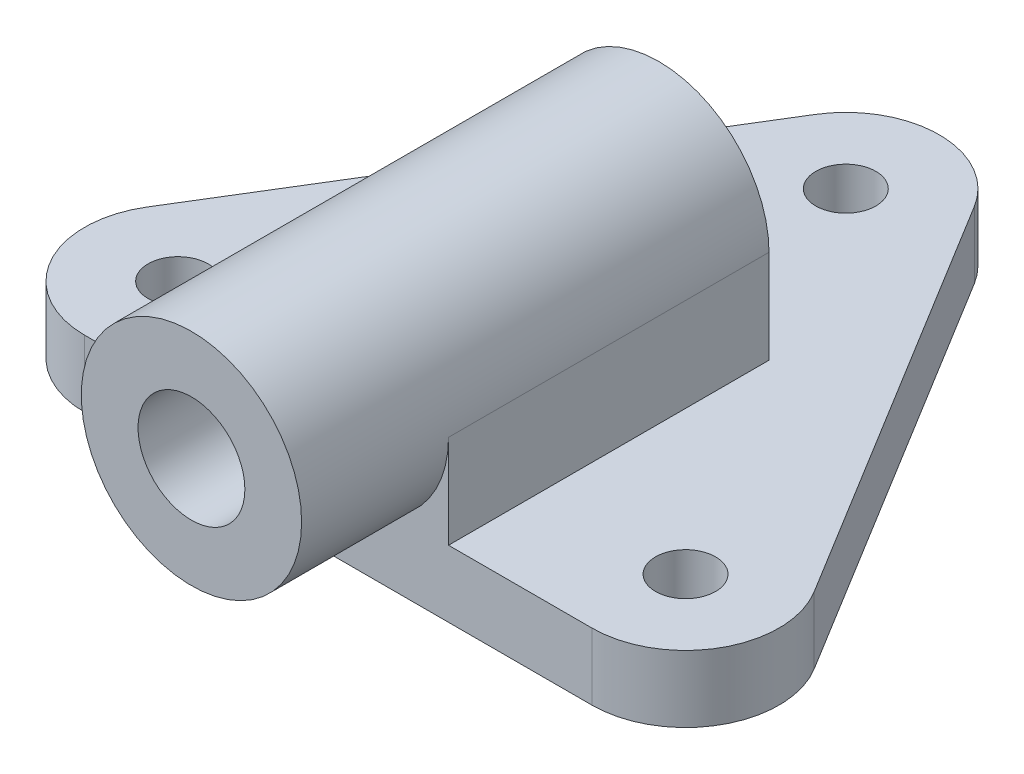
from build123d import *

# Parameters (mm, degrees)
SKETCH2_R                  = 4.5
BOSS_EXTRUDE1_DEPTH        = 10
BOSS_EXTRUDE5_DEPTH        = 22
BOSS_EXTRUDE5_DEPTH_BACK   = 48
SKETCH3_R                  = 16.5
BOSS_EXTRUDE6_DEPTH        = 48
F_16_0MM_DOWEL_HOLE1_D     = 16
F_16_0MM_DOWEL_HOLE1_DEPTH = 54
F_16_0MM_DOWEL_HOLE1_TIP   = 4.806884952


with BuildPart() as part:
    # Sketch2 → Boss-Extrude1 (new body)
    with BuildSketch(Plane(origin=(0, 0, 0), x_dir=(1, 0, 0), z_dir=(0, 1, 0))):
        with BuildLine():
            Line((11.936417534, 69.315868811), (49.936417534, 7.315868811))
            ThreePointArc((49.936417534, 7.315868811), (50.215198798, -6.840242563), (38, -14))
            Line((38, -14), (-38, -14))
            ThreePointArc((-38, -14), (-50.215198798, -6.840242563), (-49.936417534, 7.315868811))
            Line((-49.936417534, 7.315868811), (-11.936417534, 69.315868811))
            ThreePointArc((-11.936417534, 69.315868811), (0, 76), (11.936417534, 69.315868811))
        make_face()
        with Locations((0, 62)):
            Circle(SKETCH2_R, mode=Mode.SUBTRACT)
        with Locations((38, 0)):
            Circle(SKETCH2_R, mode=Mode.SUBTRACT)
        with Locations((-38, 0)):
            Circle(SKETCH2_R, mode=Mode.SUBTRACT)
    extrude(amount=BOSS_EXTRUDE1_DEPTH)

    # Sketch3 → Boss-Extrude5 (add, two sides: drawn at the far end of the back side and taken through both)
    with BuildSketch(Plane.XY.offset(14).offset(-BOSS_EXTRUDE5_DEPTH_BACK)):
        with Locations((0, 24)):
            Circle(SKETCH3_R)
    extrude(amount=BOSS_EXTRUDE5_DEPTH + BOSS_EXTRUDE5_DEPTH_BACK)

    # Sketch3<7> → Boss-Extrude6 (add)
    with BuildSketch(Plane.XY.offset(14)):
        with BuildLine():
            ThreePointArc((-8.732124598, 10), (-14.427925282, 15.994691008), (-16.5, 24))
            Line((-16.5, 24), (-16.5, 10))
            Line((-16.5, 10), (-8.732124598, 10))
        make_face()
        with BuildLine():
            Line((16.5, 10), (16.5, 24))
            ThreePointArc((16.5, 24), (14.427925282, 15.994691008), (8.732124598, 10))
            Line((8.732124598, 10), (16.5, 10))
        make_face()
    extrude(amount=-BOSS_EXTRUDE6_DEPTH)

    # Ø16.0mm Dowel Hole1
    with Locations(Plane.XY.offset(36)):
        with Locations((0, 24)):
            Hole(F_16_0MM_DOWEL_HOLE1_D / 2, depth=F_16_0MM_DOWEL_HOLE1_DEPTH)
            with Locations((0, 0, -(F_16_0MM_DOWEL_HOLE1_DEPTH + F_16_0MM_DOWEL_HOLE1_TIP / 2))):  # 118° drill point
                Cone(0, F_16_0MM_DOWEL_HOLE1_D / 2, F_16_0MM_DOWEL_HOLE1_TIP, mode=Mode.SUBTRACT)


solid = part.part
